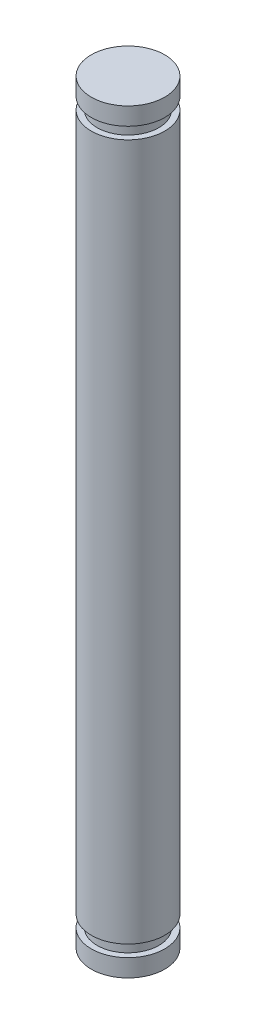
from build123d import *

# Parameters (mm, degrees)
SKETCH1_R           = 3.175
BOSS_EXTRUDE1_DEPTH = 60.198
SKETCH2_R           = 2.667
BOSS_EXTRUDE2_DEPTH = 1.016
SKETCH3_R           = 3.175
BOSS_EXTRUDE3_DEPTH = 1.524
BOSS_EXTRUDE4_START = 1.016
SKETCH4_R           = 2.667
BOSS_EXTRUDE4_DEPTH = 1.016
BOSS_EXTRUDE5_START = 1.524
SKETCH7_R           = 3.175
BOSS_EXTRUDE5_DEPTH = 1.524


with BuildPart() as part:
    # Sketch1 → Boss-Extrude1 (new body)
    with BuildSketch(Plane(origin=(0, 0, 0), x_dir=(1, 0, 0), z_dir=(0, 1, 0))):
        with Locations(Location((0, 0, 0), (0, 0, 90))):
            Circle(SKETCH1_R)
    extrude(amount=BOSS_EXTRUDE1_DEPTH)

    # Sketch2 → Boss-Extrude2 (add)
    with BuildSketch(Plane(origin=(0, 60.198, 0), x_dir=(1, 0, 0), z_dir=(0, 1, 0))):
        with Locations(Location((0, 0, 0), (0, 0, 270))):
            Circle(SKETCH2_R)
    extrude(amount=BOSS_EXTRUDE2_DEPTH)

    # Sketch3 → Boss-Extrude3 (add)
    with BuildSketch(Plane(origin=(0, 61.214, 0), x_dir=(1, 0, 0), z_dir=(0, 1, 0))):
        with Locations(Location((0, 0, 0), (0, 0, 90))):
            Circle(SKETCH3_R)
    extrude(amount=BOSS_EXTRUDE3_DEPTH)

    # Sketch4 → Boss-Extrude4 (add)
    with BuildSketch(Plane.XZ.offset(BOSS_EXTRUDE4_START)):
        with Locations(Location((0, 0, 0), (0, 0, 90))):
            Circle(SKETCH4_R)
    extrude(amount=-BOSS_EXTRUDE4_DEPTH)

    # Sketch7 → Boss-Extrude5 (add)
    with BuildSketch(Plane(origin=(0, -1.016, 0), x_dir=(-1, 0, 0), z_dir=(0, -1, 0)).offset(BOSS_EXTRUDE5_START)):
        with Locations(Location((0, 0, 0), (0, 0, 90))):
            Circle(SKETCH7_R)
    extrude(amount=-BOSS_EXTRUDE5_DEPTH)


solid = part.part
